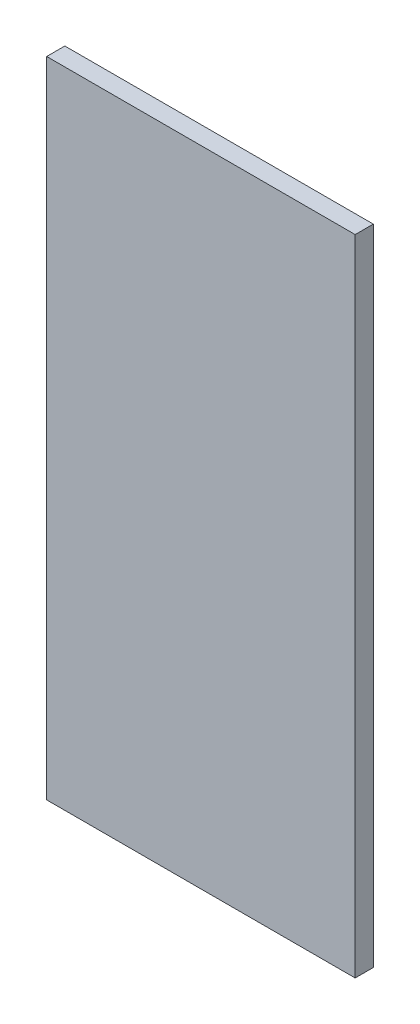
from build123d import *

# Parameters (mm, degrees)
SKETCH1_W           = 51
SKETCH1_H           = 106.45
BOSS_EXTRUDE1_DEPTH = 3


with BuildPart() as part:
    # Sketch1 → Boss-Extrude1 (new body)
    with BuildSketch(Plane.XY):
        with Locations((25.5, 53.225)):
            Rectangle(SKETCH1_W, SKETCH1_H)
    extrude(amount=BOSS_EXTRUDE1_DEPTH)


solid = part.part
